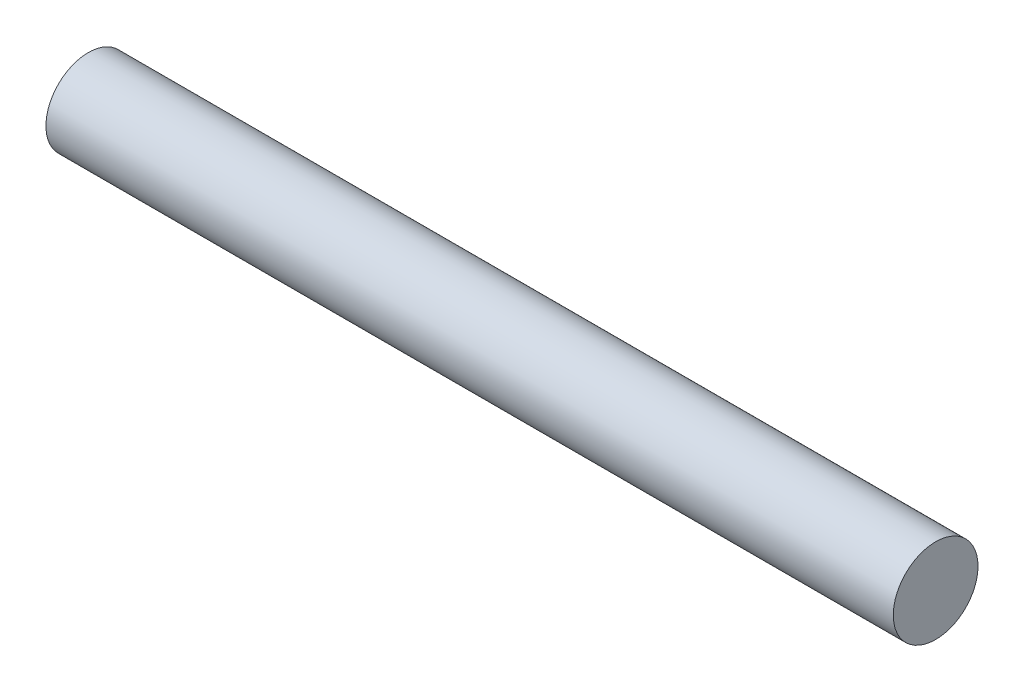
from build123d import *

# Parameters (mm, degrees)
SKETCH1_R           = 5
BOSS_EXTRUDE1_DEPTH = 100


with BuildPart() as part:
    # Sketch1 → Boss-Extrude1 (new body)
    with BuildSketch(Plane(origin=(0, 0, 0), x_dir=(0, 0, -1), z_dir=(1, 0, 0))):
        Circle(SKETCH1_R)
    extrude(amount=BOSS_EXTRUDE1_DEPTH)


solid = part.part
